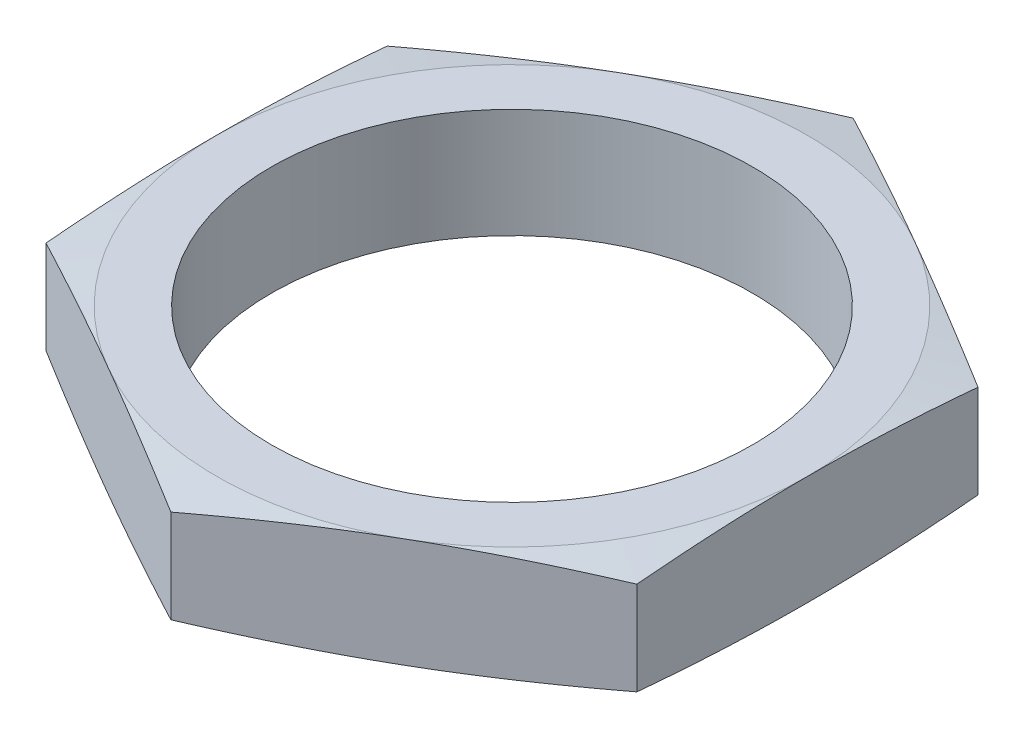
from build123d import *

# Parameters (mm, degrees)
CROQUIS1_R              = 11
SALIENTE_EXTRUIR1_DEPTH = 5
CROQUIS2_OUTSIDE_W      = 289.33
CROQUIS2_OUTSIDE_H      = 293.506
CROQUIS2_OUTSIDE_R      = 13.5
CORTAR_EXTRUIR1_DEPTH   = 22.219095174
CORTAR_EXTRUIR1_DRAFT   = -80
CROQUIS3_OUTSIDE_W      = 94.022
CROQUIS3_OUTSIDE_H      = 98.198
CROQUIS3_OUTSIDE_R      = 13.5
CORTAR_EXTRUIR2_DEPTH   = 5
CORTAR_EXTRUIR2_DRAFT   = -80


with BuildPart() as part:
    # Croquis1 → Saliente-Extruir1 (new body)
    with BuildSketch(Plane(origin=(0, 0, 0), x_dir=(1, 0, 0), z_dir=(0, 1, 0))):
        Polygon((0, 15.588457268), (-13.5, 7.794228634), (-13.5, -7.794228634), (0, -15.588457268), (13.5, -7.794228634), (13.5, 7.794228634), align=None)
        with Locations(Location((0, 0, 0), (0, 0, 270))):
            Circle(CROQUIS1_R, mode=Mode.SUBTRACT)
    extrude(amount=SALIENTE_EXTRUIR1_DEPTH)


with BuildPart() as cortar_extruir1_tool:
    # Croquis2 outside → Cortar-Extruir1 (with draft: the straight prism first)
    with BuildSketch(Plane(origin=(0, 5, 0), x_dir=(1, 0, 0), z_dir=(0, 1, 0))):
        Rectangle(CROQUIS2_OUTSIDE_W, CROQUIS2_OUTSIDE_H)
        Circle(CROQUIS2_OUTSIDE_R, mode=Mode.SUBTRACT)
    extrude(amount=-CORTAR_EXTRUIR1_DEPTH)
    # Cortar-Extruir1: the draft: its side faces are tilted about the plane it starts from
    cortar_extruir1_sides = [cortar_extruir1_tool.faces().sort_by_distance(p)[0] for p in [
        (0, -6.109547587, 146.753),
        (144.665, -6.109547587, 0),
        (0, -6.109547587, -146.753),
        (-144.665, -6.109547587, 0),
        (-13.5, -6.109547587, 0),
    ]]
    draft(cortar_extruir1_sides, Plane(origin=(0, 5, 0), x_dir=(1, 0, 0), z_dir=(0, 1, 0)), CORTAR_EXTRUIR1_DRAFT)


with BuildPart() as part_1:
    add(part.part)

    # Cortar-Extruir1: cut by cortar_extruir1_tool
    add(cortar_extruir1_tool.part, mode=Mode.SUBTRACT)


with BuildPart() as cortar_extruir2_tool:
    # Croquis3 outside → Cortar-Extruir2 (with draft: the straight prism first)
    with BuildSketch(Plane.XZ):
        Rectangle(CROQUIS3_OUTSIDE_W, CROQUIS3_OUTSIDE_H)
        Circle(CROQUIS3_OUTSIDE_R, mode=Mode.SUBTRACT)
    extrude(amount=-CORTAR_EXTRUIR2_DEPTH)
    # Cortar-Extruir2: the draft: its side faces are tilted about the plane it starts from
    cortar_extruir2_sides = [cortar_extruir2_tool.faces().sort_by_distance(p)[0] for p in [
        (0, 2.5, -49.099),
        (47.011, 2.5, 0),
        (0, 2.5, 49.099),
        (-47.011, 2.5, 0),
        (-13.5, 2.5, 0),
    ]]
    draft(cortar_extruir2_sides, Plane.XZ, CORTAR_EXTRUIR2_DRAFT)


with BuildPart() as part_2:
    add(part_1.part)

    # Cortar-Extruir2: cut by cortar_extruir2_tool
    add(cortar_extruir2_tool.part, mode=Mode.SUBTRACT)


solid = part_2.part
